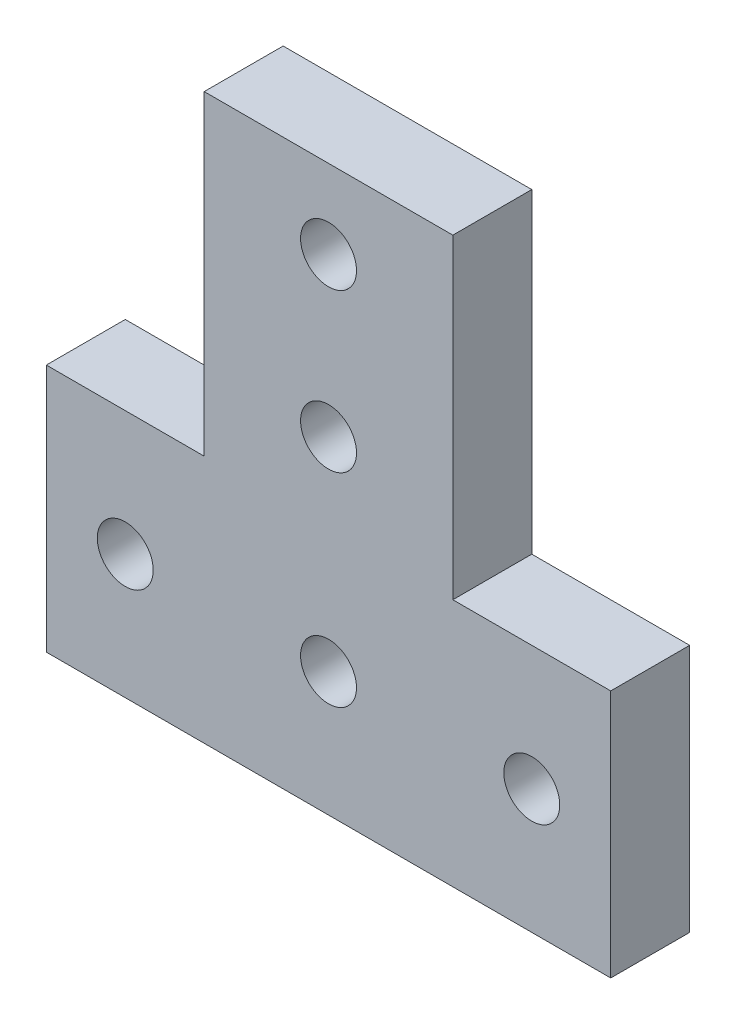
from build123d import *

# Parameters (mm, degrees)
SKETCH1_R           = 2.25
BOSS_EXTRUDE1_DEPTH = 6.35


with BuildPart() as part:
    # Sketch1 → Boss-Extrude1 (new body)
    with BuildSketch(Plane.XY):
        Polygon((-10, -12.7), (-22.7, -12.7), (-22.7, -32.7), (22.7, -32.7), (22.7, -12.7), (10, -12.7), (10, 12.7), (-10, 12.7), align=None)
        with Locations((16.35, -22.7)):
            Circle(SKETCH1_R, mode=Mode.SUBTRACT)
        with Locations((0, 6.35)):
            Circle(SKETCH1_R, mode=Mode.SUBTRACT)
        with Locations((0, -22.7)):
            Circle(SKETCH1_R, mode=Mode.SUBTRACT)
        with Locations((0, -6.35)):
            Circle(SKETCH1_R, mode=Mode.SUBTRACT)
        with Locations((-16.35, -22.7)):
            Circle(SKETCH1_R, mode=Mode.SUBTRACT)
    extrude(amount=BOSS_EXTRUDE1_DEPTH)


solid = part.part
